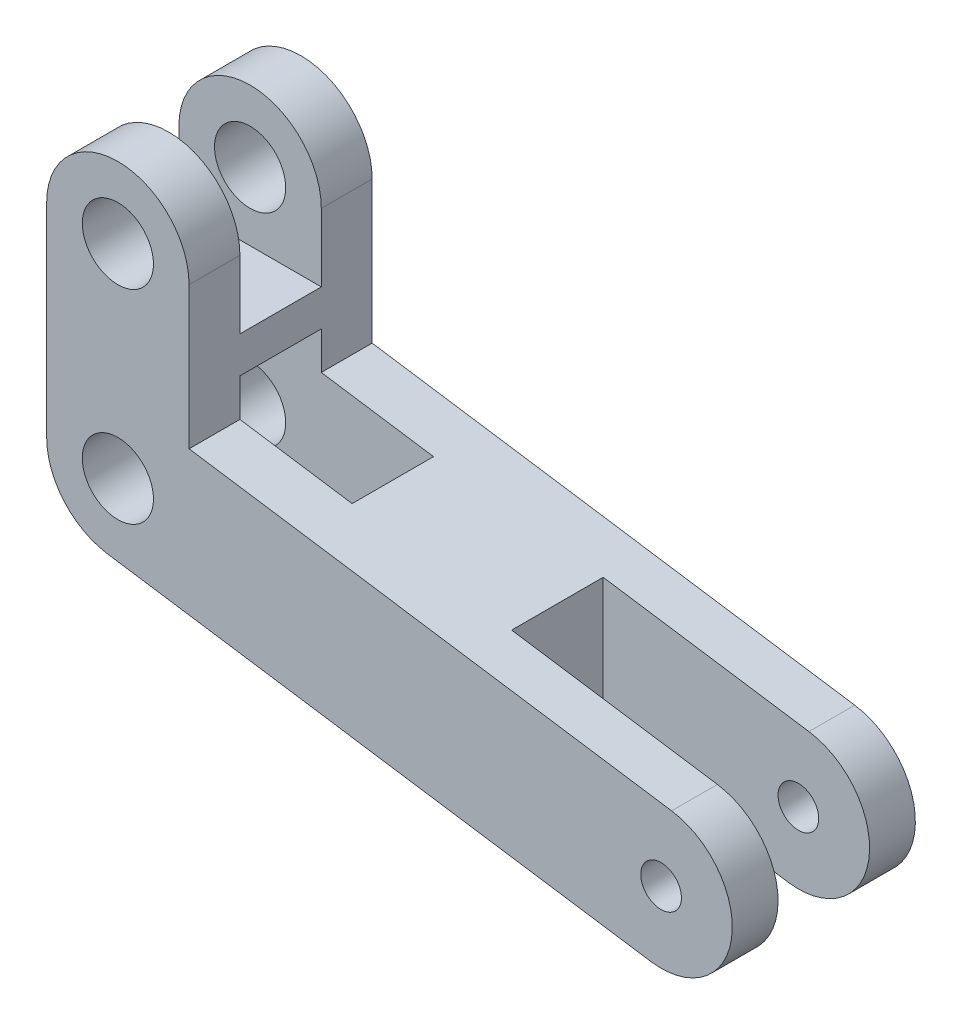
from build123d import *

# Parameters (mm, degrees)
SKETCH_1_R          = 1.75
SKETCH_1_R_2        = 1
EXTRUDE_1_DEPTH     = 4.5
SKETCH_5_W          = 9.199682462
SKETCH_5_H          = 9.813167506
SKETCH_5_W_2        = 14.660354758
SKETCH_5_H_2        = 10.525453646
CUT_EXTRUDE_3_DEPTH = 2
SKETCH_6_W          = 19.186818514
SKETCH_6_H          = 12
CUT_EXTRUDE_4_DEPTH = 2.25


with BuildPart() as part:
    # 草图1 → 凸台-拉伸1 (new, symmetric)
    with BuildSketch(Plane.XY):
        with BuildLine():
            Line((26.183541327, -7.461378128), (-0.518518519, -3.461378128))
            ThreePointArc((-0.518518519, -3.461378128), (-2.651868663, -2.284205024), (-3.5, 0))
            Line((-3.5, 0), (-3.5, 10))
            ThreePointArc((-3.5, 10), (0, 13.5), (3.5, 10))
            Line((3.5, 10), (3.5, 3.014748692))
            Line((3.5, 3.014748692), (27.220578364, -0.538621872))
            ThreePointArc((27.220578364, -0.538621872), (30.163437974, -4.518518519), (26.183541327, -7.461378128))
        make_face()
        Circle(SKETCH_1_R, mode=Mode.SUBTRACT)
        with Locations((0, 10)):
            Circle(SKETCH_1_R, mode=Mode.SUBTRACT)
        with Locations((26.702059846, -4)):
            Circle(SKETCH_1_R_2, mode=Mode.SUBTRACT)
    extrude(amount=EXTRUDE_1_DEPTH, both=True)

    # 草图5 → 切除-拉伸3 (cut, symmetric)
    with BuildSketch(Plane.XY):
        with Locations((-1.099841231, 11.563279791)):
            Rectangle(SKETCH_5_W, SKETCH_5_H)
        with Locations((1.684655549, -0.393377614)):
            Rectangle(SKETCH_5_W_2, SKETCH_5_H_2)
    extrude(amount=CUT_EXTRUDE_3_DEPTH, both=True, mode=Mode.SUBTRACT)

    # 草图6 → 切除-拉伸4 (cut, symmetric)
    with BuildSketch(Plane.XY):
        with Locations((26.702059846, -4)):
            Rectangle(SKETCH_6_W, SKETCH_6_H)
    extrude(amount=CUT_EXTRUDE_4_DEPTH, both=True, mode=Mode.SUBTRACT)


solid = part.part
